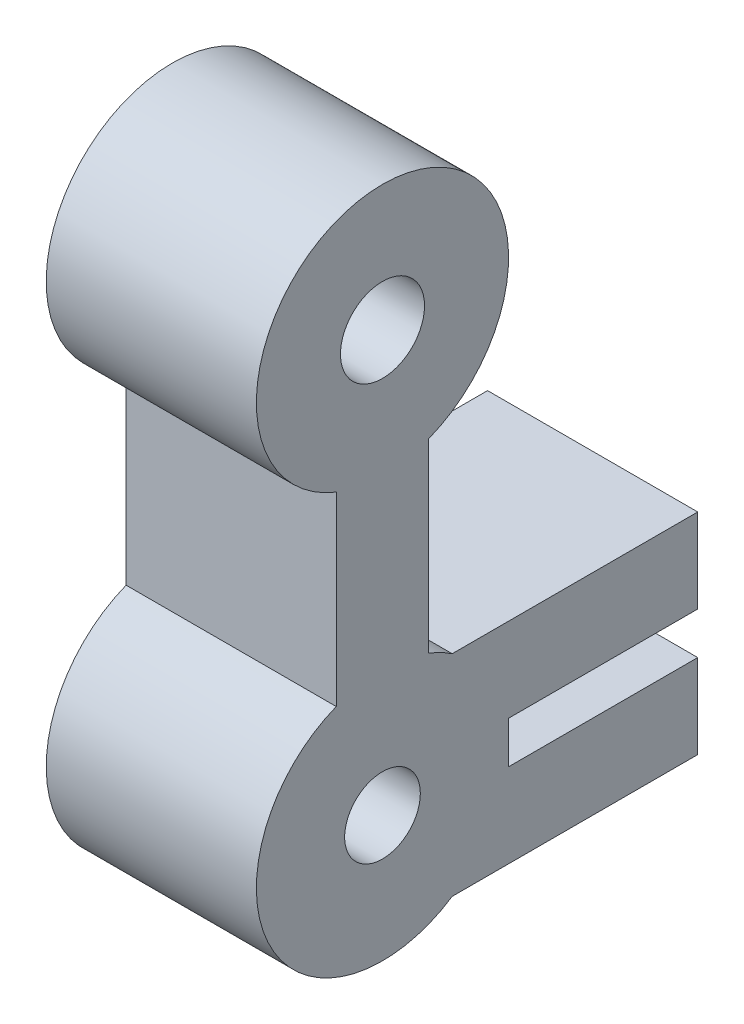
from build123d import *

# Parameters (mm, degrees)
SKETCH1_R           = 9
SKETCH1_R_2         = 10
BOSS_EXTRUDE1_DEPTH = 50


with BuildPart() as part:
    # Sketch1 → Boss-Extrude1 (new body)
    with BuildSketch(Plane.YZ):
        with BuildLine():
            Line((-25, -16.583123952), (-25, -75))
            Line((-25, -75), (-5, -75))
            Line((-5, -75), (-5, -30))
            Line((-5, -30), (5, -30))
            Line((5, -30), (5, -75))
            Line((5, -75), (25, -75))
            Line((25, -75), (25, -16.583123952))
            ThreePointArc((25, -16.583123952), (26.602160846, -13.868130311), (27.910571474, -11))
            Line((27.910571474, -11), (72.089428526, -11))
            ThreePointArc((72.089428526, -11), (130, 0), (72.089428526, 11))
            Line((72.089428526, 11), (27.910571474, 11))
            ThreePointArc((27.910571474, 11), (-13.868130311, 26.602160846), (-25, -16.583123952))
        make_face()
        with Locations(Location((0, 0, 0), (0, 0, 270))):
            Circle(SKETCH1_R, mode=Mode.SUBTRACT)
        with Locations(Location((100, 0, 0), (0, 0, 270))):
            Circle(SKETCH1_R_2, mode=Mode.SUBTRACT)
    extrude(amount=-BOSS_EXTRUDE1_DEPTH)


solid = part.part
